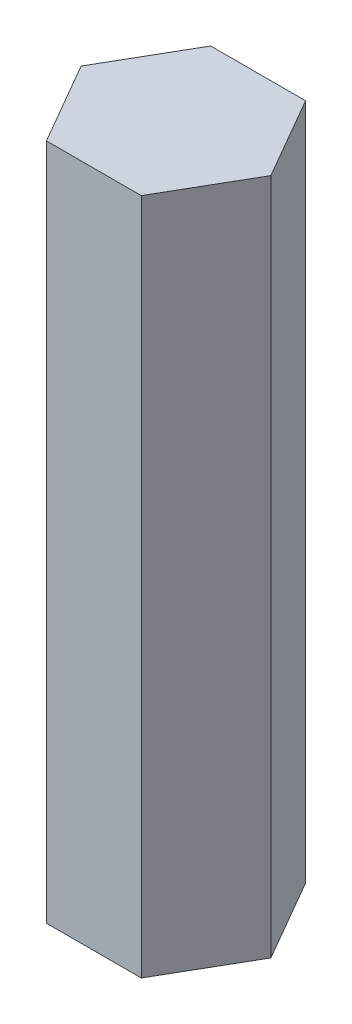
from build123d import *

# Parameters (mm, degrees)
EXTRUDE_1_DEPTH = 5000


with BuildPart() as part:
    # 草图1 → 凸台-拉伸1 (new body)
    with BuildSketch(Plane(origin=(0, 0, 0), x_dir=(1, 0, 0), z_dir=(0, 1, 0))):
        Polygon((700, 0), (350, 606.217782649), (-350, 606.217782649), (-700, 0), (-350, -606.217782649), (350, -606.217782649), align=None)
    extrude(amount=EXTRUDE_1_DEPTH)


solid = part.part
